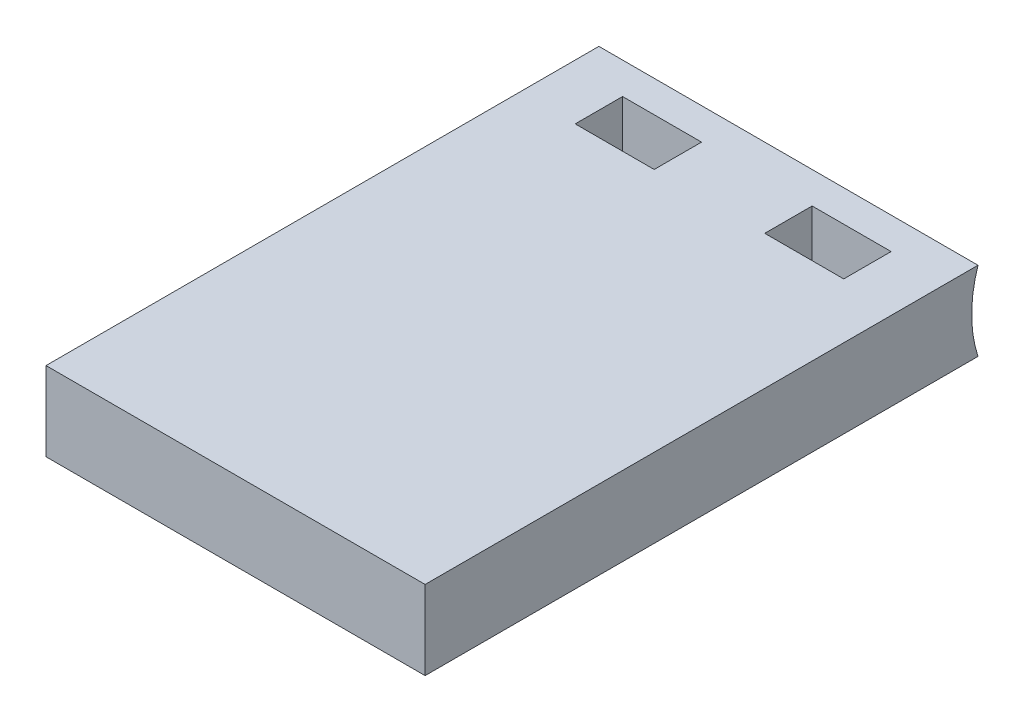
from build123d import *

# Parameters (mm, degrees)
SCHIZZO2_W                 = 24
SCHIZZO2_H                 = 35
BASESUPPORTO_DEPTH         = 5
SCHIZZO3_R                 = 8
APPOGGIOALLONGHERONE_DEPTH = 31.120590964
SCHIZZO4_W                 = 5
SCHIZZO4_H                 = 3
FORIFASCETTE_DEPTH         = 22.800229357


with BuildPart() as part:
    # Schizzo2 → BaseSupporto (new body)
    with BuildSketch(Plane(origin=(0, 0, 0), x_dir=(1, 0, 0), z_dir=(0, 1, 0))):
        Rectangle(SCHIZZO2_W, SCHIZZO2_H)
    extrude(amount=BASESUPPORTO_DEPTH)

    # Schizzo3 → AppoggioAlLongherone (cut, through all)
    with BuildSketch(Plane.ZY.offset(12)):
        with Locations((-25.099342077, 2.5)):
            Circle(SCHIZZO3_R)
    extrude(amount=-APPOGGIOALLONGHERONE_DEPTH, mode=Mode.SUBTRACT)

    # Schizzo4 → ForiFascette (cut, through all)
    with BuildSketch(Plane(origin=(0, 5, 0), x_dir=(1, 0, 0), z_dir=(0, 1, 0))):
        with Locations((-6, 14)):
            Rectangle(SCHIZZO4_W, SCHIZZO4_H)
        with Locations((6, 14)):
            Rectangle(SCHIZZO4_W, SCHIZZO4_H)
    extrude(amount=-FORIFASCETTE_DEPTH, mode=Mode.SUBTRACT)


solid = part.part
